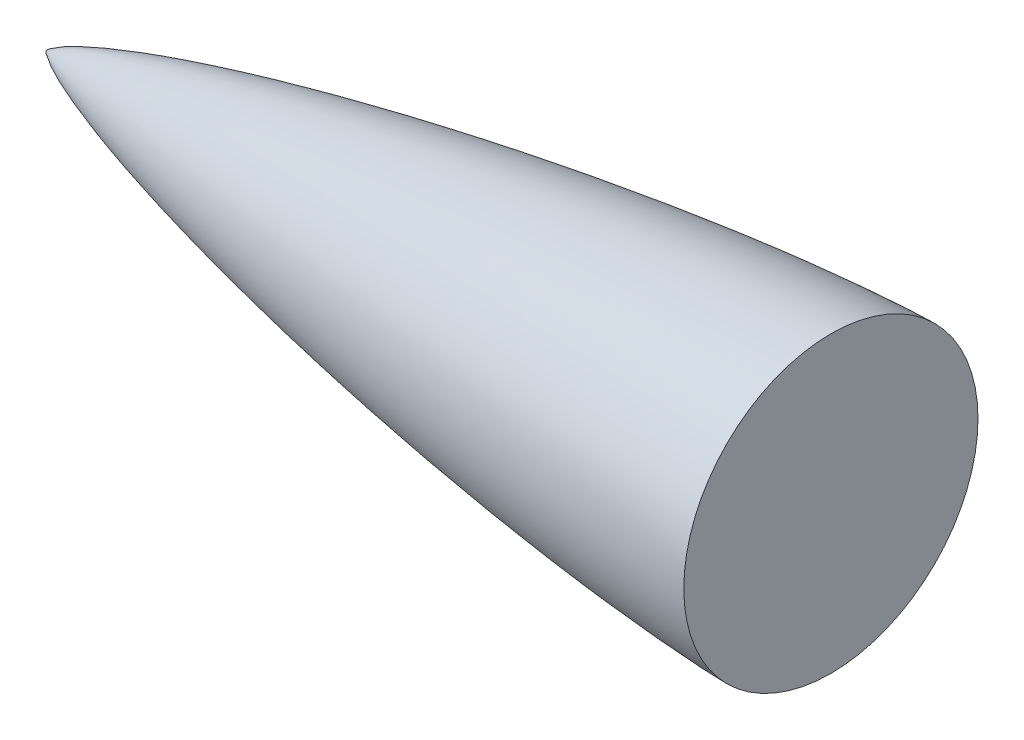
from build123d import *


with BuildPart() as part:
    # Sketch6 → Revolve6 (revolve)
    with BuildSketch(Plane.XY):
        with BuildLine():
            Line((0, 0), (16, 0))
            Line((16, 0), (16, 3))
            add(Edge.make_bspline(
                [(0, 0), (0.001085117, 0.003027667), (0.003712936, 0.008044451), (0.008861956, 0.014311024), (0.016894753, 0.023131592), (0.02780284, 0.033525966), (0.045007881, 0.048170167), (0.074823728, 0.070549115), (0.127040022, 0.104971538), (0.219554776, 0.158217083), (0.382568964, 0.239626476), (0.652230491, 0.356312125), (1.116525629, 0.531107266), (1.784988204, 0.748243125), (2.625851367, 0.988200765), (3.5978374, 1.23552594), (4.600044112, 1.467005656), (5.857844886, 1.733515154), (7.12100108, 1.973604292), (8.38826992, 2.19079915), (9.659062338, 2.385999858), (10.677632565, 2.52900872), (11.698020213, 2.658403386), (12.720145638, 2.773375561), (13.743967801, 2.872113979), (14.691876278, 2.945871742), (15.384454238, 2.984027135), (15.820700508, 2.998477208), (16, 3)],
                knots=[0, 0, 0, 0, 0, 0.000782785, 0.001389648, 0.001958755, 0.002922941, 0.004458062, 0.006909971, 0.011061133, 0.018197342, 0.030525386, 0.051411258, 0.082826797, 0.139382495, 0.20221365, 0.265044804, 0.327875964, 0.390707127, 0.516369449, 0.579200612, 0.642031775, 0.704862937, 0.767694099, 0.830525261, 0.893356422, 0.956187582, 1, 1, 1, 1, 1], degree=4))
        make_face()
    revolve(axis=Axis((0, 0, 0), (1, 0, 0)))


solid = part.part
